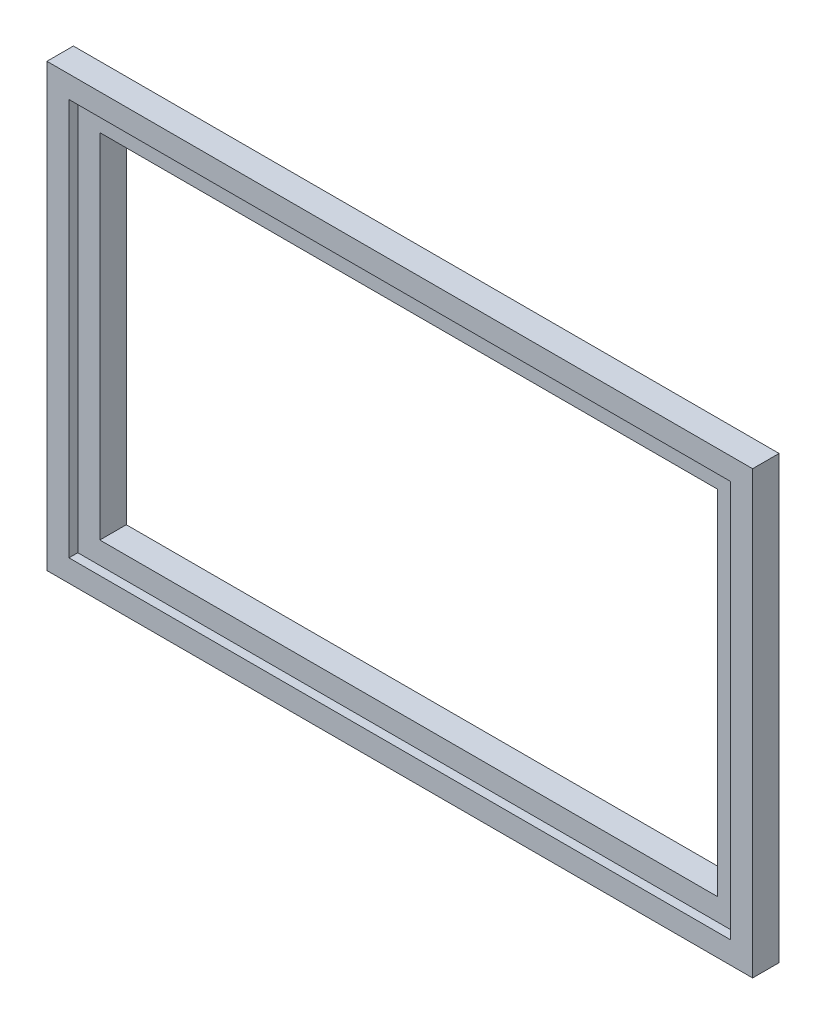
from build123d import *

# Parameters (mm, degrees)
SKETCH_1_W      = 80
SKETCH_1_H      = 50
SKETCH_1_W_2    = 75
SKETCH_1_H_2    = 45
SKETCH_1_W_3    = 70
SKETCH_1_H_3    = 40
EXTRUDE_1_DEPTH = 2
SKETCH_2_W      = 80
SKETCH_2_H      = 50
SKETCH_2_W_2    = 75
SKETCH_2_H_2    = 45
EXTRUDE_2_DEPTH = 1
SKETCH_3_W      = 75
SKETCH_3_H      = 45
SKETCH_3_W_2    = 70
SKETCH_3_H_2    = 40
EXTRUDE_3_DEPTH = 1


with BuildPart() as part:
    # 스케치1 → 보스-돌출1 (new body)
    # profile 1 of 2: a face of its own
    with BuildSketch(Plane.XY):
        with Locations((-40, 25)):
            Rectangle(SKETCH_1_W, SKETCH_1_H)
        with Locations((-40, 25)):
            Rectangle(SKETCH_1_W_2, SKETCH_1_H_2, mode=Mode.SUBTRACT)
    # profile 2 of 2: a face of its own
    with BuildSketch(Plane.XY):
        with Locations((-40, 25)):
            Rectangle(SKETCH_1_W_2, SKETCH_1_H_2)
        with Locations((-40, 25)):
            Rectangle(SKETCH_1_W_3, SKETCH_1_H_3, mode=Mode.SUBTRACT)
    extrude(amount=EXTRUDE_1_DEPTH)

    # 스케치2 → 보스-돌출2 (add)
    with BuildSketch(Plane.XY.offset(2)):
        with Locations((-40, 25)):
            Rectangle(SKETCH_2_W, SKETCH_2_H)
        with Locations((-40, 25)):
            Rectangle(SKETCH_2_W_2, SKETCH_2_H_2, mode=Mode.SUBTRACT)
    extrude(amount=EXTRUDE_2_DEPTH)

    # 스케치3 → 보스-돌출3 (add)
    with BuildSketch(Plane(origin=(0, 0, 0), x_dir=(-1, 0, 0), z_dir=(0, 0, -1))):
        with Locations((40, 25)):
            Rectangle(SKETCH_3_W, SKETCH_3_H)
        with Locations((40, 25)):
            Rectangle(SKETCH_3_W_2, SKETCH_3_H_2, mode=Mode.SUBTRACT)
    extrude(amount=EXTRUDE_3_DEPTH)


solid = part.part
